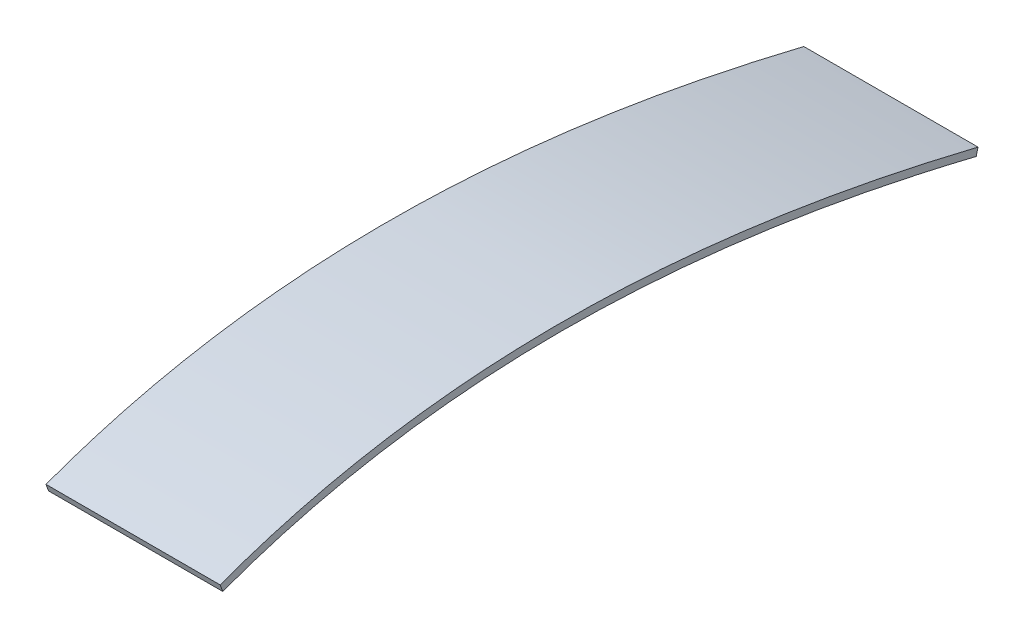
from build123d import *

# Parameters (mm, degrees)
BOSS_EXTRUDE1_DEPTH      = 350
BOSS_EXTRUDE1_DEPTH_BACK = 350


with BuildPart() as part:
    # Sketch2 → Boss-Extrude1 (new, two sides: drawn at the far end of the back side and taken through both)
    with BuildSketch(Plane(origin=(0, 0, 0), x_dir=(0, 0, -1), z_dir=(1, 0, 0)).offset(-BOSS_EXTRUDE1_DEPTH_BACK)):
        with BuildLine():
            Line((628.154342243, 1334.840970334), (635.276466748, 1363.983299386))
            add(Edge.make_bspline(
                [(635.276466748, 1363.983299386), (619.957390753, 1367.72714451), (589.330417146, 1375.139984347), (543.172309386, 1386.089202533), (496.870720267, 1396.843374703), (434.926793802, 1410.917229945), (357.130814236, 1427.989325486), (263.22982252, 1447.578641927), (168.827358301, 1466.204795293), (42.346273159, 1489.667836014), (-116.792406765, 1516.259917629), (-309.071946528, 1543.26473064), (-566.733477317, 1572.02641996), (-890.360773009, 1593.073417312), (-1213.742406532, 1590.711575527), (-1470.90446444, 1572.645298882), (-1662.652442521, 1550.472496905), (-1852.922942756, 1519.141407627), (-2009.952474043, 1484.954111895), (-2134.47884907, 1452.489680909), (-2227.277630338, 1425.518007468), (-2304.081508723, 1400.797610657), (-2365.170358382, 1379.646930282), (-2395.617007214, 1368.598973009), (-2410.790335611, 1362.964590755)],
                knots=[0, 0, 0, 0, 0.015625, 0.03125, 0.046875, 0.0625, 0.09375, 0.125, 0.15625, 0.1875, 0.25, 0.3125, 0.375, 0.5, 0.625, 0.6875, 0.75, 0.8125, 0.875, 0.90625, 0.9375, 0.96875, 0.984375, 1, 1, 1, 1], degree=3))
            Line((-2410.790335611, 1362.964590755), (-2400.347061488, 1334.840970334))
            add(Edge.make_bspline(
                [(628.154342243, 1334.840970334), (-348.254688721, 1573.466602271), (-1437.488159342, 1692.383822459), (-2400.347061488, 1334.840970334)],
                knots=[0, 0, 0, 0, 1, 1, 1, 1], degree=3))
        make_face()
    extrude(amount=BOSS_EXTRUDE1_DEPTH + BOSS_EXTRUDE1_DEPTH_BACK)


solid = part.part
